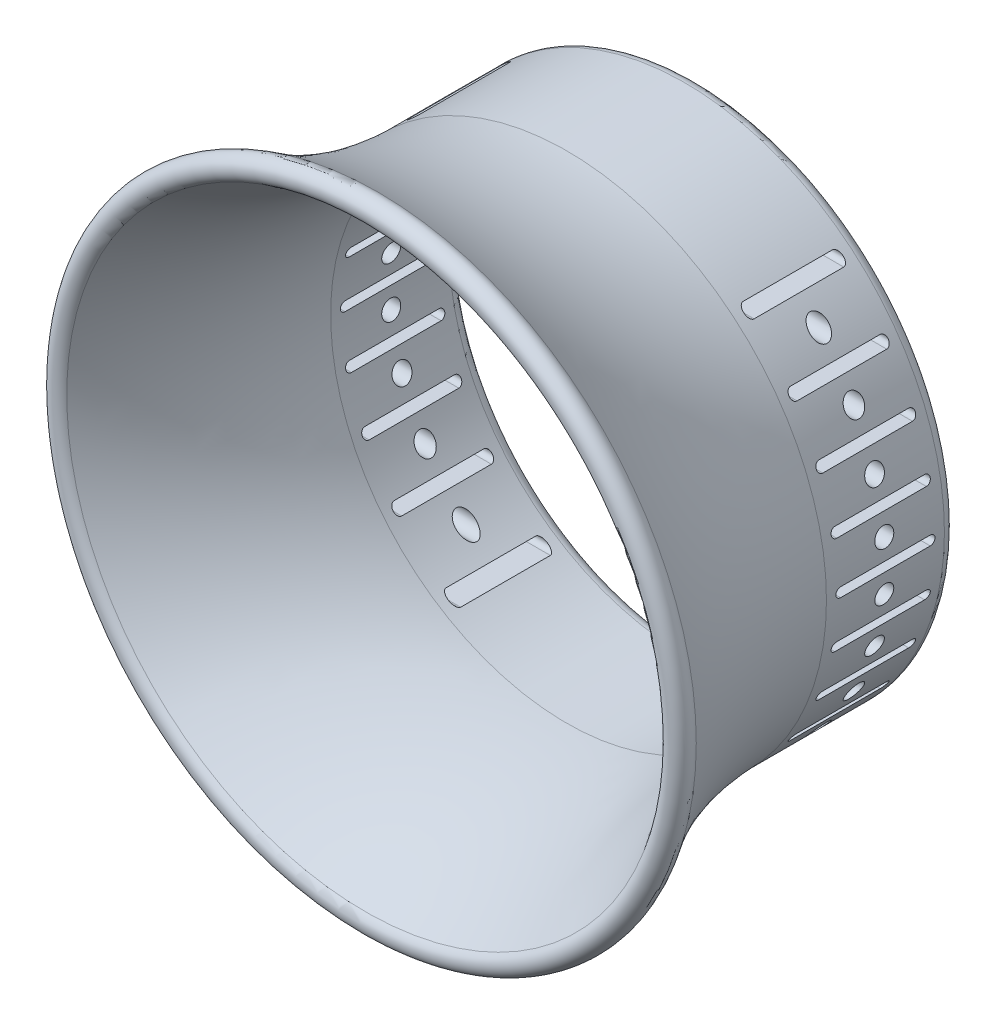
from build123d import *

# Parameters (mm, degrees)
CUT_EXTRUDE2_DEPTH      = 154.448257122
CUT_EXTRUDE2_DEPTH_BACK = 154.448257122
CUT_EXTRUDE3_DEPTH      = 154.448257122
CUT_EXTRUDE3_DEPTH_BACK = 154.448257122
SKETCH5_R               = 2.006001184


with BuildPart() as part:
    # Sketch1 → Revolve1 (revolve)
    with BuildSketch(Plane(origin=(0, 0, 0), x_dir=(0, 0, -1), z_dir=(1, 0, 0)), mode=Mode.PRIVATE) as revolve1_sk:
        with BuildLine():
            Line((17.818447519, 55), (-7.181552481, 55))
            add(Edge.make_bspline(
                [(-7.181552481, 55), (-29.140183376, 55.570570673), (-47.181552481, 67.415917468)],
                knots=[0, 0, 0, 1, 1, 1], degree=2))
            ThreePointArc((-47.181552481, 67.415917468), (-50.643471873, 66.698202953), (-49.925757358, 63.236283561))
            add(Edge.make_bspline(
                [(-7.246501248, 50), (-15.983270505, 50.21748961), (-29.675981443, 53.414899567), (-42.724023013, 58.505518691), (-49.925757358, 63.236283561)],
                knots=[-0.00147839, -0.00147839, -0.00147839, 0.374076006, 0.624445604, 1, 1, 1], degree=2))
            Line((-7.246501248, 50), (17.818447519, 50))
            ThreePointArc((17.818447519, 50), (20.318447519, 52.5), (17.818447519, 55))
        make_face()
    revolve(revolve1_sk.sketch.rotate(Axis((0, 0, 41.235909689), (0, 0, -1)), 90), axis=Axis((0, 0, 41.235909689), (0, 0, -1)))

    # Sketch4 → Cut-Extrude2 (cut, two sides: drawn at the far end of the back side and taken through both)
    with BuildSketch(Plane(origin=(60, 0, 0), x_dir=(0, 0, -1), z_dir=(1, 0, 0)).offset(-CUT_EXTRUDE2_DEPTH_BACK)):
        with BuildLine():
            Line((-4.181552481, 1), (14.818447519, 1))
            ThreePointArc((14.818447519, 1), (15.818447519, 0), (14.818447519, -1))
            Line((14.818447519, -1), (-4.181552481, -1))
            ThreePointArc((-4.181552481, -1), (-5.181552481, 0), (-4.181552481, 1))
        make_face()
        with BuildLine():
            Line((-4.181552481, 11.5), (14.818447519, 11.5))
            ThreePointArc((14.818447519, 11.5), (15.818447519, 10.5), (14.818447519, 9.5))
            Line((14.818447519, 9.5), (-4.181552481, 9.5))
            ThreePointArc((-4.181552481, 9.5), (-5.181552481, 10.5), (-4.181552481, 11.5))
        make_face()
        with BuildLine():
            Line((-4.181552481, 22), (14.818447519, 22))
            ThreePointArc((14.818447519, 22), (15.818447519, 21), (14.818447519, 20))
            Line((14.818447519, 20), (-4.181552481, 20))
            ThreePointArc((-4.181552481, 20), (-5.181552481, 21), (-4.181552481, 22))
        make_face()
        with BuildLine():
            Line((-4.181552481, 32.5), (14.818447519, 32.5))
            ThreePointArc((14.818447519, 32.5), (15.818447519, 31.5), (14.818447519, 30.5))
            Line((14.818447519, 30.5), (-4.181552481, 30.5))
            ThreePointArc((-4.181552481, 30.5), (-5.181552481, 31.5), (-4.181552481, 32.5))
        make_face()
        with BuildLine():
            Line((-4.181552481, 43), (14.818447519, 43))
            ThreePointArc((14.818447519, 43), (15.818447519, 42), (14.818447519, 41))
            Line((14.818447519, 41), (-4.181552481, 41))
            ThreePointArc((-4.181552481, 41), (-5.181552481, 42), (-4.181552481, 43))
        make_face()
        with BuildLine():
            Line((-4.181552481, -11.5), (14.818447519, -11.5))
            ThreePointArc((14.818447519, -11.5), (15.818447519, -10.5), (14.818447519, -9.5))
            Line((14.818447519, -9.5), (-4.181552481, -9.5))
            ThreePointArc((-4.181552481, -9.5), (-5.181552481, -10.5), (-4.181552481, -11.5))
        make_face()
        with BuildLine():
            Line((-4.181552481, -22), (14.818447519, -22))
            ThreePointArc((14.818447519, -22), (15.818447519, -21), (14.818447519, -20))
            Line((14.818447519, -20), (-4.181552481, -20))
            ThreePointArc((-4.181552481, -20), (-5.181552481, -21), (-4.181552481, -22))
        make_face()
        with BuildLine():
            Line((-4.181552481, -32.5), (14.818447519, -32.5))
            ThreePointArc((14.818447519, -32.5), (15.818447519, -31.5), (14.818447519, -30.5))
            Line((14.818447519, -30.5), (-4.181552481, -30.5))
            ThreePointArc((-4.181552481, -30.5), (-5.181552481, -31.5), (-4.181552481, -32.5))
        make_face()
        with BuildLine():
            Line((-4.181552481, -43), (14.818447519, -43))
            ThreePointArc((14.818447519, -43), (15.818447519, -42), (14.818447519, -41))
            Line((14.818447519, -41), (-4.181552481, -41))
            ThreePointArc((-4.181552481, -41), (-5.181552481, -42), (-4.181552481, -43))
        make_face()
    extrude(amount=CUT_EXTRUDE2_DEPTH + CUT_EXTRUDE2_DEPTH_BACK, mode=Mode.SUBTRACT)

    # Sketch5 → Cut-Extrude3 (cut, two sides: drawn at the far end of the back side and taken through both)
    with BuildSketch(Plane(origin=(60, 0, 0), x_dir=(0, 0, -1), z_dir=(1, 0, 0)).offset(-CUT_EXTRUDE3_DEPTH_BACK)):
        with Locations((5.318447519, -5.25)):
            Circle(SKETCH5_R)
        with Locations((5.318447519, 5.25)):
            Circle(SKETCH5_R)
        with Locations((5.318447519, 15.75)):
            Circle(SKETCH5_R)
        with Locations((5.318447519, 26.25)):
            Circle(SKETCH5_R)
        with Locations((5.318447519, 36.75)):
            Circle(SKETCH5_R)
        with Locations((5.318447519, -15.75)):
            Circle(SKETCH5_R)
        with Locations((5.318447519, -26.25)):
            Circle(SKETCH5_R)
        with Locations((5.318447519, -36.75)):
            Circle(SKETCH5_R)
    extrude(amount=CUT_EXTRUDE3_DEPTH + CUT_EXTRUDE3_DEPTH_BACK, mode=Mode.SUBTRACT)


solid = part.part
